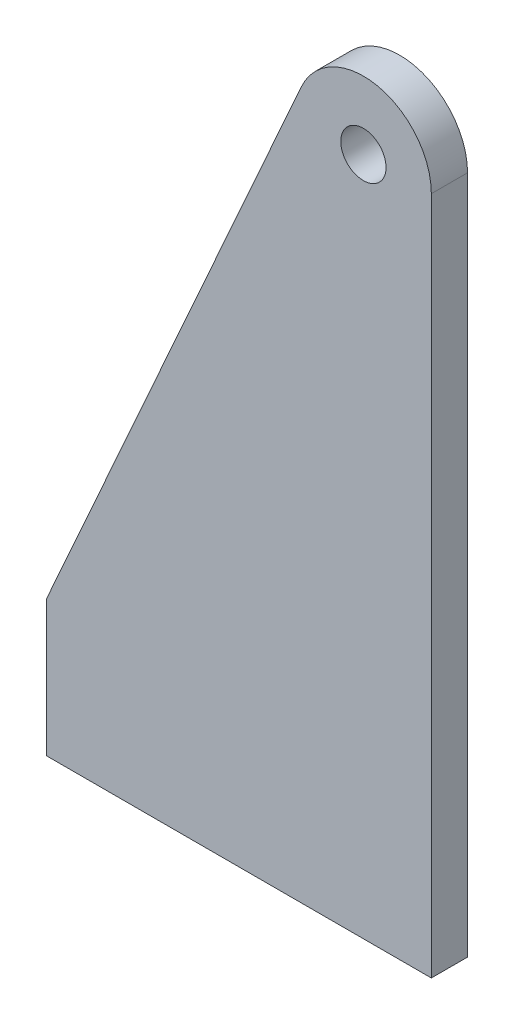
from build123d import *

# Parameters (mm, degrees)
SKETCH_1_R      = 5
EXTRUDE_1_DEPTH = 8


with BuildPart() as part:
    # ｽｹｯﾁ1 → ﾎﾞｽ - 押し出し1 (new body)
    with BuildSketch(Plane.XY):
        with BuildLine():
            Line((0, 0), (0, 150))
            ThreePointArc((0, 150), (-11.873899678, 164.670633823), (-28.69699957, 156.114916416))
            Line((-28.69699957, 156.114916416), (-85, 30))
            Line((-85, 30), (-85, 0))
            Line((-85, 0), (0, 0))
        make_face()
        with Locations((-15, 150)):
            Circle(SKETCH_1_R, mode=Mode.SUBTRACT)
    extrude(amount=EXTRUDE_1_DEPTH)


solid = part.part
